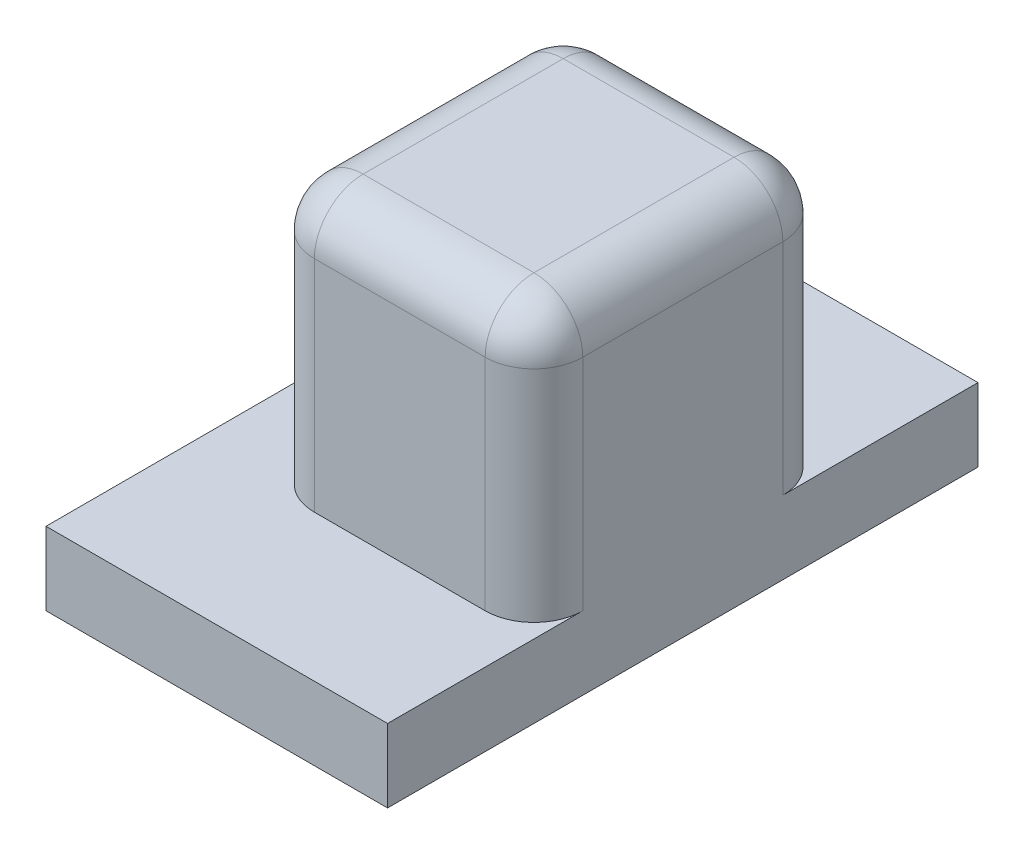
from build123d import *

# Parameters (mm, degrees)
SKETCH1_W           = 5.5
SKETCH1_H           = 6.1
SKETCH1_W_2         = 3.3
SKETCH1_H_2         = 3.3
BOSS_EXTRUDE1_DEPTH = 7
SKETCH2_W           = 5.5
SKETCH2_H           = 6.1
BOSS_EXTRUDE2_DEPTH = 1.5
SKETCH3_W           = 7
SKETCH3_H           = 12.1
SKETCH3_W_2         = 3.3
SKETCH3_H_2         = 3.3
BOSS_EXTRUDE3_DEPTH = 1.5
FILLET1_R           = 1


with BuildPart() as part:
    # Sketch1 → Boss-Extrude1 (new body)
    with BuildSketch(Plane(origin=(0, 0, 0), x_dir=(1, 0, 0), z_dir=(0, 1, 0))):
        with Locations((2.75, 3.05)):
            Rectangle(SKETCH1_W, SKETCH1_H)
        with Locations((2.85, 3.05)):
            Rectangle(SKETCH1_W_2, SKETCH1_H_2, mode=Mode.SUBTRACT)
    extrude(amount=BOSS_EXTRUDE1_DEPTH)

    # Sketch2 → Boss-Extrude2 (add)
    with BuildSketch(Plane(origin=(0, 7, 0), x_dir=(1, 0, 0), z_dir=(0, 1, 0))):
        with Locations((2.75, 3.05)):
            Rectangle(SKETCH2_W, SKETCH2_H)
    extrude(amount=-BOSS_EXTRUDE2_DEPTH)

    # Sketch3 → Boss-Extrude3 (add)
    with BuildSketch(Plane(origin=(0, 0, 0), x_dir=(1, 0, 0), z_dir=(0, 1, 0))):
        with Locations((2, 3.05)):
            Rectangle(SKETCH3_W, SKETCH3_H)
        with Locations((2.85, 3.05)):
            Rectangle(SKETCH3_W_2, SKETCH3_H_2, mode=Mode.SUBTRACT)
    extrude(amount=BOSS_EXTRUDE3_DEPTH)

    # Fillet1
    fillet1_edges = [part.edges().sort_by_distance(p)[0] for p in [
        (5.5, 7, -3.05),
        (2.75, 7, -6.1),
        (0, 7, -3.05),
        (0, 4.25, -6.1),
        (5.5, 4.25, -6.1),
        (5.5, 4.25, 0),
        (0, 4.25, 0),
        (2.75, 7, 0),
    ]]
    fillet(fillet1_edges, radius=FILLET1_R)


solid = part.part
